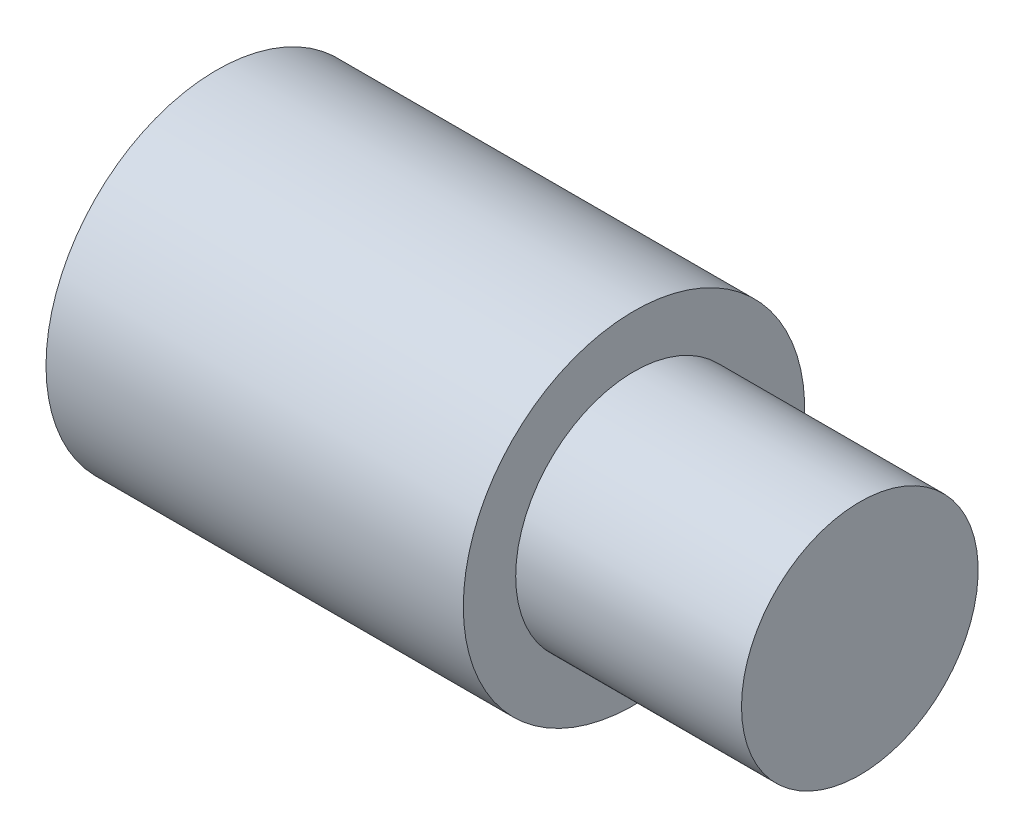
from build123d import *

# Parameters (mm, degrees)
SOCKET_SKETCH_W = 16.2
SOCKET_SKETCH_H = 3.175


with BuildPart() as part:
    # Conn_T4_ORB6 Sketch → Conn_T4_ORB6 (revolve)
    with BuildSketch(Plane.XY):
        Polygon((12.5, 0), (12.5, 6.55), (0, 6.55), (0, 9.45), (-23.1, 9.45), (-23.1, 0), align=None)
    revolve(axis=Axis((-1000, 0, 0), (1, 0, 0)))

    # Socket Sketch → Socket (revolve, cut)
    with BuildSketch(Plane.XY):
        with Locations((-16, 1.5875)):
            Rectangle(SOCKET_SKETCH_W, SOCKET_SKETCH_H)
    revolve(axis=Axis((-1000, 0, 0), (1, 0, 0)), mode=Mode.SUBTRACT)


solid = part.part
